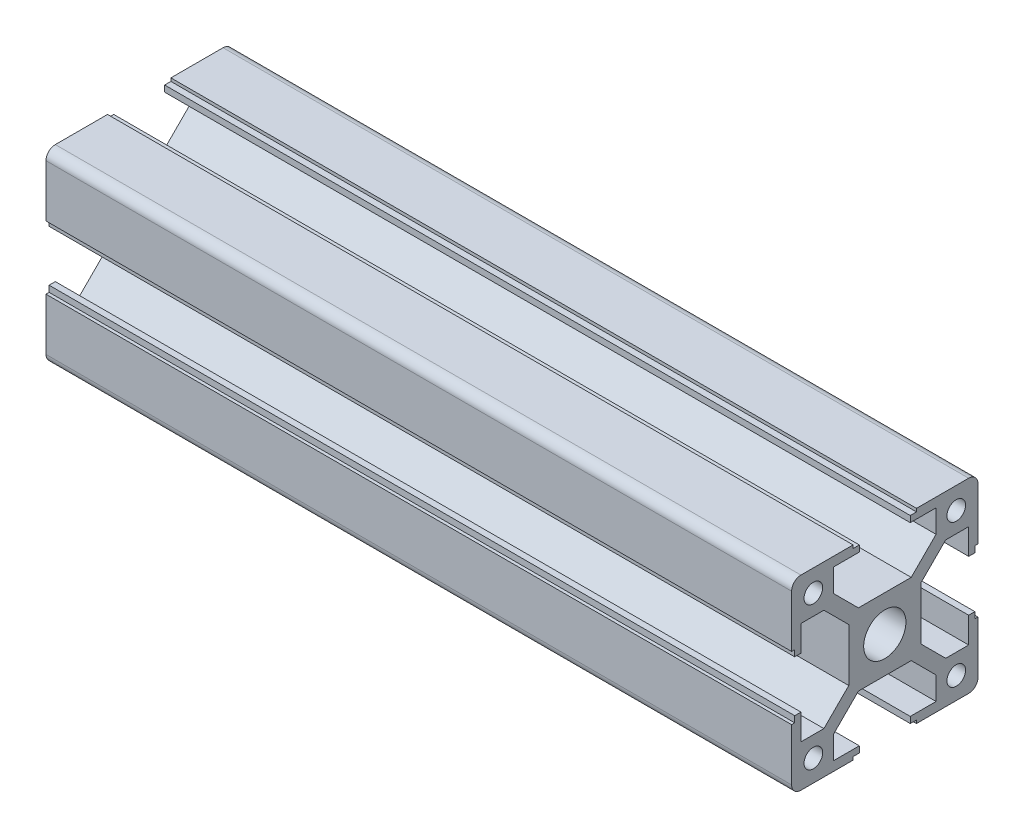
from build123d import *

# Parameters (mm, degrees)
SKETCH12_R               = 3.4
SKETCH12_R_2             = 1.5
F_30X_30G_X_R1_5_1_DEPTH = 120


with BuildPart() as part:
    # Sketch12 → 铝型材 30X 30G X R1.5(1) (new body)
    with BuildSketch(Plane(origin=(0, 0, 0), x_dir=(0, 0, -1), z_dir=(1, 0, 0))):
        with BuildLine():
            Line((-5.1, 15), (-5.1, 14.5))
            Line((-5.1, 14.5), (-4.1, 14.5))
            Line((-4.1, 14.5), (-4.1, 13.5))
            Line((-4.1, 13.5), (-8.25, 13.5))
            Line((-8.25, 13.5), (-8.25, 9.8))
            Line((-8.25, 9.8), (-4.25, 5.8))
            Line((-4.25, 5.8), (4.25, 5.8))
            Line((4.25, 5.8), (8.25, 9.8))
            Line((8.25, 9.8), (8.25, 13.5))
            Line((8.25, 13.5), (4.1, 13.5))
            Line((4.1, 13.5), (4.1, 14.5))
            Line((4.1, 14.5), (5.1, 14.5))
            Line((5.1, 14.5), (5.1, 15))
            Line((5.1, 15), (13.5, 15))
            ThreePointArc((13.5, 15), (14.560660172, 14.560660172), (15, 13.5))
            Line((15, 13.5), (15, 5.1))
            Line((15, 5.1), (14.5, 5.1))
            Line((14.5, 5.1), (14.5, 4.1))
            Line((14.5, 4.1), (13.5, 4.1))
            Line((13.5, 4.1), (13.5, 8.25))
            Line((13.5, 8.25), (9.8, 8.25))
            Line((9.8, 8.25), (5.8, 4.25))
            Line((5.8, 4.25), (5.8, -4.25))
            Line((5.8, -4.25), (9.8, -8.25))
            Line((9.8, -8.25), (13.5, -8.25))
            Line((13.5, -8.25), (13.5, -4.1))
            Line((13.5, -4.1), (14.5, -4.1))
            Line((14.5, -4.1), (14.5, -5.1))
            Line((14.5, -5.1), (15, -5.1))
            Line((15, -5.1), (15, -13.5))
            ThreePointArc((15, -13.5), (14.560660172, -14.560660172), (13.5, -15))
            Line((13.5, -15), (5.1, -15))
            Line((5.1, -15), (5.1, -14.5))
            Line((5.1, -14.5), (4.1, -14.5))
            Line((4.1, -14.5), (4.1, -13.5))
            Line((4.1, -13.5), (8.25, -13.5))
            Line((8.25, -13.5), (8.25, -9.8))
            Line((8.25, -9.8), (4.25, -5.8))
            Line((4.25, -5.8), (-4.25, -5.8))
            Line((-4.25, -5.8), (-8.25, -9.8))
            Line((-8.25, -9.8), (-8.25, -13.5))
            Line((-8.25, -13.5), (-4.1, -13.5))
            Line((-4.1, -13.5), (-4.1, -14.5))
            Line((-4.1, -14.5), (-5.1, -14.5))
            Line((-5.1, -14.5), (-5.1, -15))
            Line((-5.1, -15), (-13.5, -15))
            ThreePointArc((-13.5, -15), (-14.560660172, -14.560660172), (-15, -13.5))
            Line((-15, -13.5), (-15, -5.1))
            Line((-15, -5.1), (-14.5, -5.1))
            Line((-14.5, -5.1), (-14.5, -4.1))
            Line((-14.5, -4.1), (-13.5, -4.1))
            Line((-13.5, -4.1), (-13.5, -8.25))
            Line((-13.5, -8.25), (-9.8, -8.25))
            Line((-9.8, -8.25), (-5.8, -4.25))
            Line((-5.8, -4.25), (-5.8, 4.25))
            Line((-5.8, 4.25), (-9.8, 8.25))
            Line((-9.8, 8.25), (-13.5, 8.25))
            Line((-13.5, 8.25), (-13.5, 4.1))
            Line((-13.5, 4.1), (-14.5, 4.1))
            Line((-14.5, 4.1), (-14.5, 5.1))
            Line((-14.5, 5.1), (-15, 5.1))
            Line((-15, 5.1), (-15, 13.5))
            ThreePointArc((-15, 13.5), (-14.560660172, 14.560660172), (-13.5, 15))
            Line((-13.5, 15), (-5.1, 15))
        make_face()
        Circle(SKETCH12_R, mode=Mode.SUBTRACT)
        with Locations((-11.5, 11.5)):
            Circle(SKETCH12_R_2, mode=Mode.SUBTRACT)
        with Locations((11.5, 11.5)):
            Circle(SKETCH12_R_2, mode=Mode.SUBTRACT)
        with Locations((-11.5, -11.5)):
            Circle(SKETCH12_R_2, mode=Mode.SUBTRACT)
        with Locations((11.5, -11.5)):
            Circle(SKETCH12_R_2, mode=Mode.SUBTRACT)
    extrude(amount=F_30X_30G_X_R1_5_1_DEPTH)


solid = part.part
